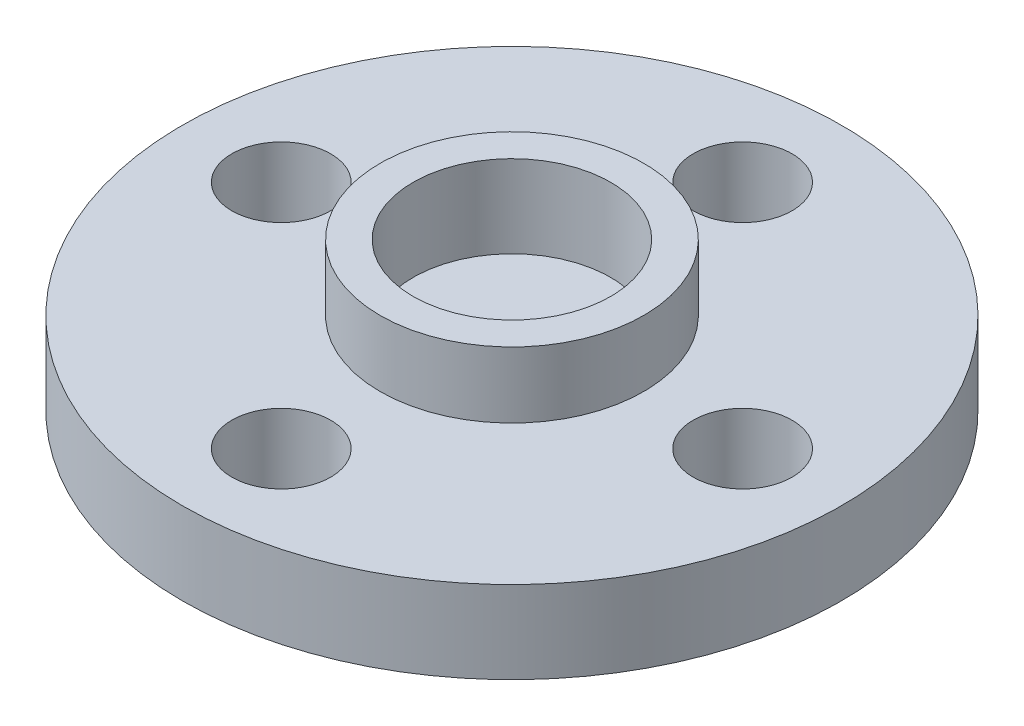
from build123d import *

# Parameters (mm, degrees)
SKETCH1_R                      = 10
BOSS_EXTRUDE1_DEPTH            = 2.5
SKETCH2_R                      = 4
SKETCH2_R_2                    = 3
BOSS_EXTRUDE2_DEPTH            = 2
CUT_EXTRUDE1_START             = -0.5
SKETCH3_R                      = 3
CUT_EXTRUDE1_DEPTH             = 0.5
CUT_EXTRUDE3_REACH             = 16.361
SKETCH4_R                      = 1.5
CUT_EXTRUDE3_DIRECTION_2_DEPTH = 15.361406616


with BuildPart() as part:
    # Sketch1 → Boss-Extrude1 (new body)
    with BuildSketch(Plane(origin=(0, 0, 0), x_dir=(1, 0, 0), z_dir=(0, 1, 0))):
        with Locations(Location((0, 0, 0), (0, 0, 270))):
            Circle(SKETCH1_R)
    extrude(amount=BOSS_EXTRUDE1_DEPTH)

    # Sketch2 → Boss-Extrude2 (add)
    with BuildSketch(Plane(origin=(0, 2.5, 0), x_dir=(1, 0, 0), z_dir=(0, 1, 0))):
        with Locations(Location((0, 0, 0), (0, 0, 270))):
            Circle(SKETCH2_R)
        with Locations(Location((0, 0, 0), (0, 0, 270))):
            Circle(SKETCH2_R_2, mode=Mode.SUBTRACT)
    extrude(amount=BOSS_EXTRUDE2_DEPTH)

    # Sketch3 → Cut-Extrude1 (cut)
    with BuildSketch(Plane(origin=(0, 2.5, 0), x_dir=(1, 0, 0), z_dir=(0, 1, 0)).offset(CUT_EXTRUDE1_START)):
        with Locations(Location((0, 0, 0), (0, 0, 270))):
            Circle(SKETCH3_R)
    extrude(amount=CUT_EXTRUDE1_DEPTH, mode=Mode.SUBTRACT)

    # Sketch4 → Cut-Extrude3 (cut, up to next)
    with BuildSketch(Plane(origin=(0, 2, 0), x_dir=(1, 0, 0), z_dir=(0, 1, 0)), mode=Mode.PRIVATE) as cut_extrude3_sk1:
        with Locations(Location((0, 7, 0), (0, 0, 270))):
            Circle(SKETCH4_R)
    cut_extrude3_tool1 = extrude(cut_extrude3_sk1.sketch, amount=-CUT_EXTRUDE3_REACH, mode=Mode.PRIVATE) & part.part
    # Sketch4 → Cut-Extrude3 (cut, up to next)
    with BuildSketch(Plane(origin=(0, 2, 0), x_dir=(1, 0, 0), z_dir=(0, 1, 0)), mode=Mode.PRIVATE) as cut_extrude3_sk2:
        with Locations(Location((7, 0, 0), (0, 0, 270))):
            Circle(SKETCH4_R)
    cut_extrude3_tool2 = extrude(cut_extrude3_sk2.sketch, amount=-CUT_EXTRUDE3_REACH, mode=Mode.PRIVATE) & part.part
    # Sketch4 → Cut-Extrude3 (cut, up to next)
    with BuildSketch(Plane(origin=(0, 2, 0), x_dir=(1, 0, 0), z_dir=(0, 1, 0)), mode=Mode.PRIVATE) as cut_extrude3_sk3:
        with Locations(Location((0, -7, 0), (0, 0, 270))):
            Circle(SKETCH4_R)
    cut_extrude3_tool3 = extrude(cut_extrude3_sk3.sketch, amount=-CUT_EXTRUDE3_REACH, mode=Mode.PRIVATE) & part.part
    # Sketch4 → Cut-Extrude3 (cut, up to next)
    with BuildSketch(Plane(origin=(0, 2, 0), x_dir=(1, 0, 0), z_dir=(0, 1, 0)), mode=Mode.PRIVATE) as cut_extrude3_sk4:
        with Locations(Location((-7, 0, 0), (0, 0, 270))):
            Circle(SKETCH4_R)
    cut_extrude3_tool4 = extrude(cut_extrude3_sk4.sketch, amount=-CUT_EXTRUDE3_REACH, mode=Mode.PRIVATE) & part.part
    add(cut_extrude3_tool1.solids().sort_by_distance((0, 2, -7))[0], mode=Mode.SUBTRACT)
    add(cut_extrude3_tool2.solids().sort_by_distance((7, 2, 0))[0], mode=Mode.SUBTRACT)
    add(cut_extrude3_tool3.solids().sort_by_distance((0, 2, 7))[0], mode=Mode.SUBTRACT)
    add(cut_extrude3_tool4.solids().sort_by_distance((-7, 2, 0))[0], mode=Mode.SUBTRACT)

    # Sketch4 → Cut-Extrude3 direction 2 (cut)
    with BuildSketch(Plane(origin=(0, 2, 0), x_dir=(1, 0, 0), z_dir=(0, 1, 0))):
        with Locations(Location((0, 7, 0), (0, 0, 270))):
            Circle(SKETCH4_R)
        with Locations(Location((7, 0, 0), (0, 0, 270))):
            Circle(SKETCH4_R)
        with Locations(Location((0, -7, 0), (0, 0, 270))):
            Circle(SKETCH4_R)
        with Locations(Location((-7, 0, 0), (0, 0, 270))):
            Circle(SKETCH4_R)
    extrude(amount=CUT_EXTRUDE3_DIRECTION_2_DEPTH, mode=Mode.SUBTRACT)


solid = part.part
